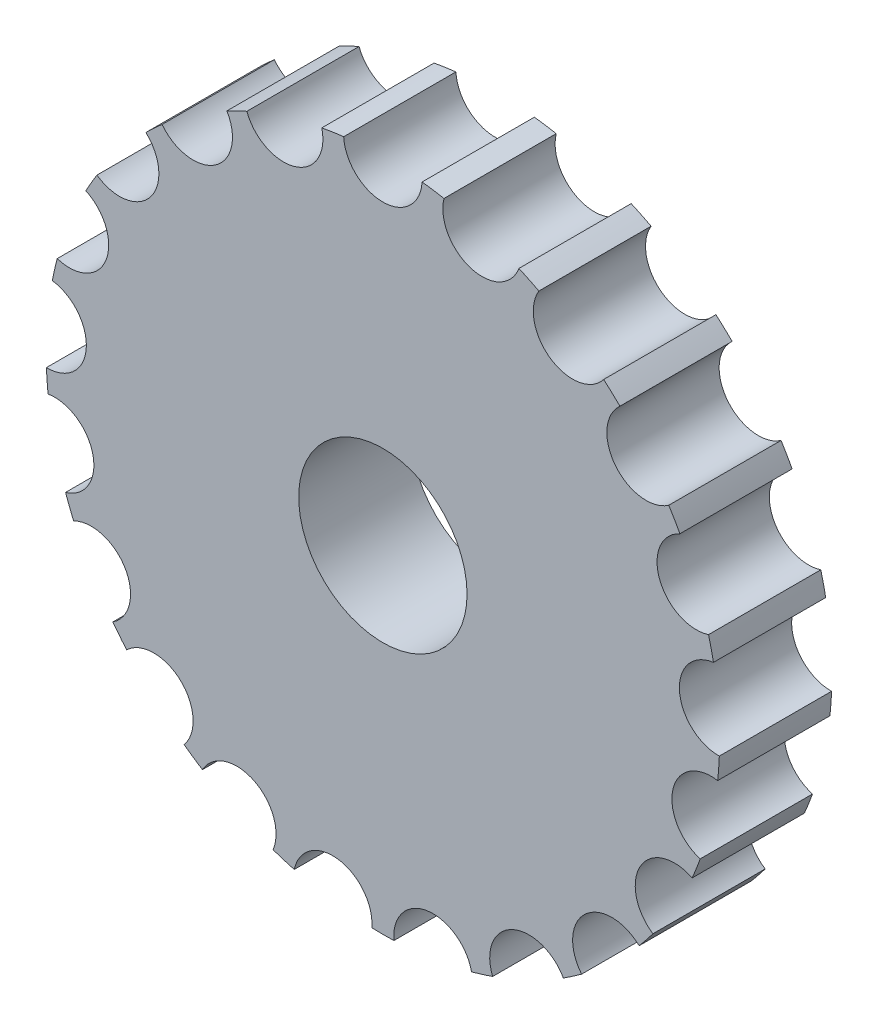
from build123d import *

# Parameters (mm, degrees)
SKETCH1_R           = 38.1
SKETCH1_R_2         = 9.525
BOSS_EXTRUDE1_DEPTH = 12.7
SKETCH2_R           = 4.445
CUT_EXTRUDE1_DEPTH  = 56.358016583
CIRPATTERN1_COUNT   = 21


with BuildPart() as part:
    # Sketch1 → Boss-Extrude1 (new body)
    with BuildSketch(Plane.XY):
        Circle(SKETCH1_R)
        Circle(SKETCH1_R_2, mode=Mode.SUBTRACT)
    extrude(amount=BOSS_EXTRUDE1_DEPTH)

    # Sketch2 → Cut-Extrude1 (cut, through all)
    with BuildSketch(Plane.XY.offset(12.7)):
        with Locations((0, 38.1)):
            Circle(SKETCH2_R)
    cut_extrude1 = extrude(amount=-CUT_EXTRUDE1_DEPTH, mode=Mode.SUBTRACT)

    # CirPattern1: Cut-Extrude1 ×21 about axis
    cirpattern1_axis = Axis((0, 0, 0), (0, 0, 1))
    for i in range(1, CIRPATTERN1_COUNT):
        add(cut_extrude1.rotate(cirpattern1_axis, i * 360 / CIRPATTERN1_COUNT), mode=Mode.SUBTRACT)


solid = part.part
